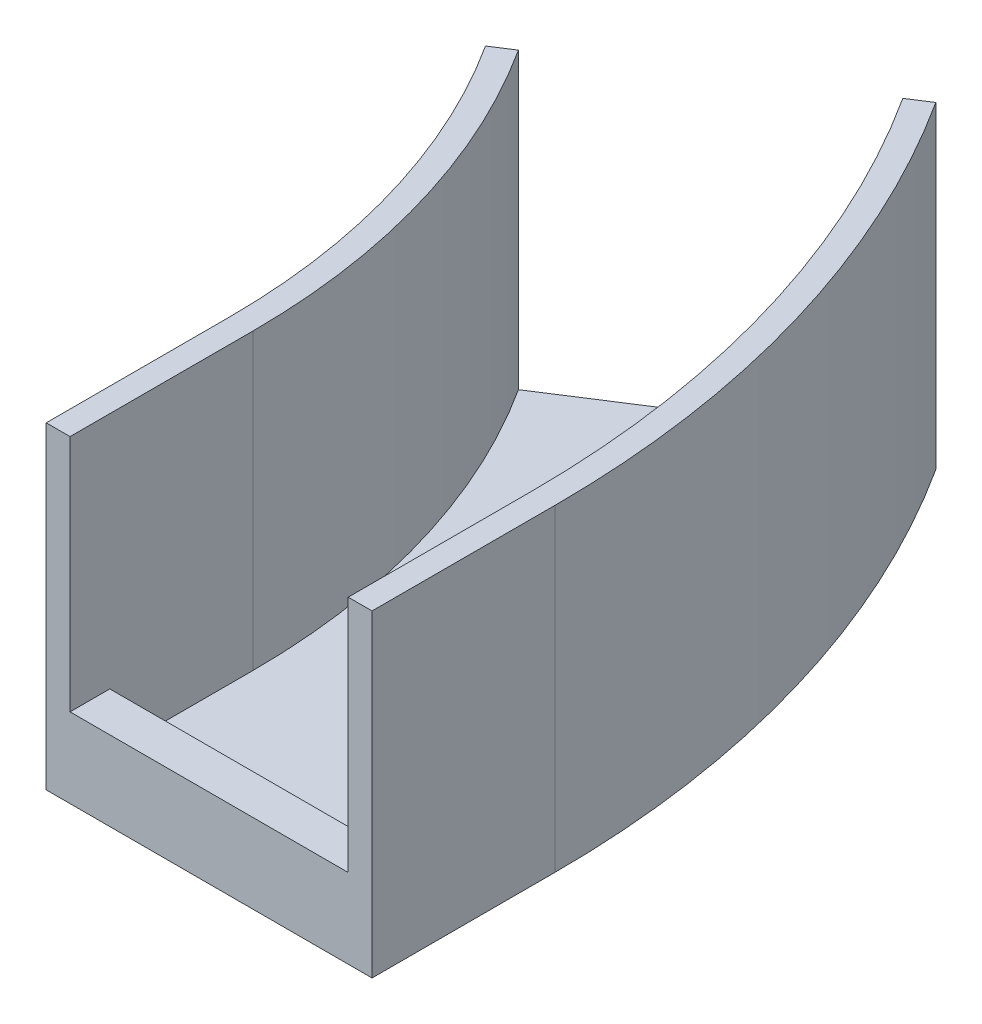
from build123d import *

# Parameters (mm, degrees)
BOSS_EXTRUDE1_DEPTH   = 40
BOSS_EXTRUDE1_2_DEPTH = 40
BOSS_EXTRUDE2_DEPTH   = 10
BOSS_EXTRUDE3_DEPTH   = 3


with BuildPart() as part:
    # Sketch1 → Boss-Extrude1 (new body)
    with BuildSketch(Plane(origin=(0, 0, 0), x_dir=(1, 0, 0), z_dir=(0, 1, 0))):
        with BuildLine():
            Line((87.5, 0), (87.5, -20))
            Line((87.5, -20), (87.5, -23))
            Line((87.5, -23), (84.5, -23))
            Line((84.5, -23), (84.5, 0))
            ThreePointArc((84.5, 0), (81.074511679, 23.815405855), (71.075773822, 45.699938464))
            Line((71.075773822, 45.699938464), (73.599174076, 47.322421486))
            ThreePointArc((73.599174076, 47.322421486), (83.952896709, 24.660923222), (87.5, 0))
        make_face()
    extrude(amount=BOSS_EXTRUDE1_DEPTH)



with BuildPart() as body_2:
    # Sketch1 → Boss-Extrude1 2 (new body)
    with BuildSketch(Plane(origin=(0, 0, 0), x_dir=(1, 0, 0), z_dir=(0, 1, 0))):
        with BuildLine():
            Line((122.5, 0), (122.5, -20))
            Line((122.5, -20), (122.5, -23))
            Line((122.5, -23), (125.5, -23))
            Line((125.5, -23), (125.5, 0))
            ThreePointArc((125.5, 0), (120.412440423, 35.370809879), (105.56224396, 67.873873103))
            Line((105.56224396, 67.873873103), (103.038843706, 66.251390081))
            ThreePointArc((103.038843706, 66.251390081), (117.534055393, 34.525292511), (122.5, 0))
        make_face()
    extrude(amount=BOSS_EXTRUDE1_2_DEPTH)


with BuildPart() as part_1:
    add(part.part)

    add(body_2.part)  # Boss-Extrude2 merges body 2
    # Sketch2 → Boss-Extrude2 (add)
    with BuildSketch(Plane.XZ):
        Polygon((87.5, 23), (122.5, 23), (122.5, 18), (87.482549511, 18), align=None)
    extrude(amount=-BOSS_EXTRUDE2_DEPTH)

    # Sketch3 → Boss-Extrude3 (add)
    with BuildSketch(Plane.XZ):
        with BuildLine():
            Line((73.599174076, -47.322421486), (103.038843706, -66.251390081))
            ThreePointArc((103.038843706, -66.251390081), (117.534055393, -34.525292511), (122.5, 0))
            Line((122.5, 0), (122.5, 18))
            Line((122.5, 18), (87.5, 18))
            Line((87.5, 18), (87.5, 0))
            ThreePointArc((87.5, 0), (83.952896709, -24.660923222), (73.599174076, -47.322421486))
        make_face()
    extrude(amount=-BOSS_EXTRUDE3_DEPTH)


solid = part_1.part
